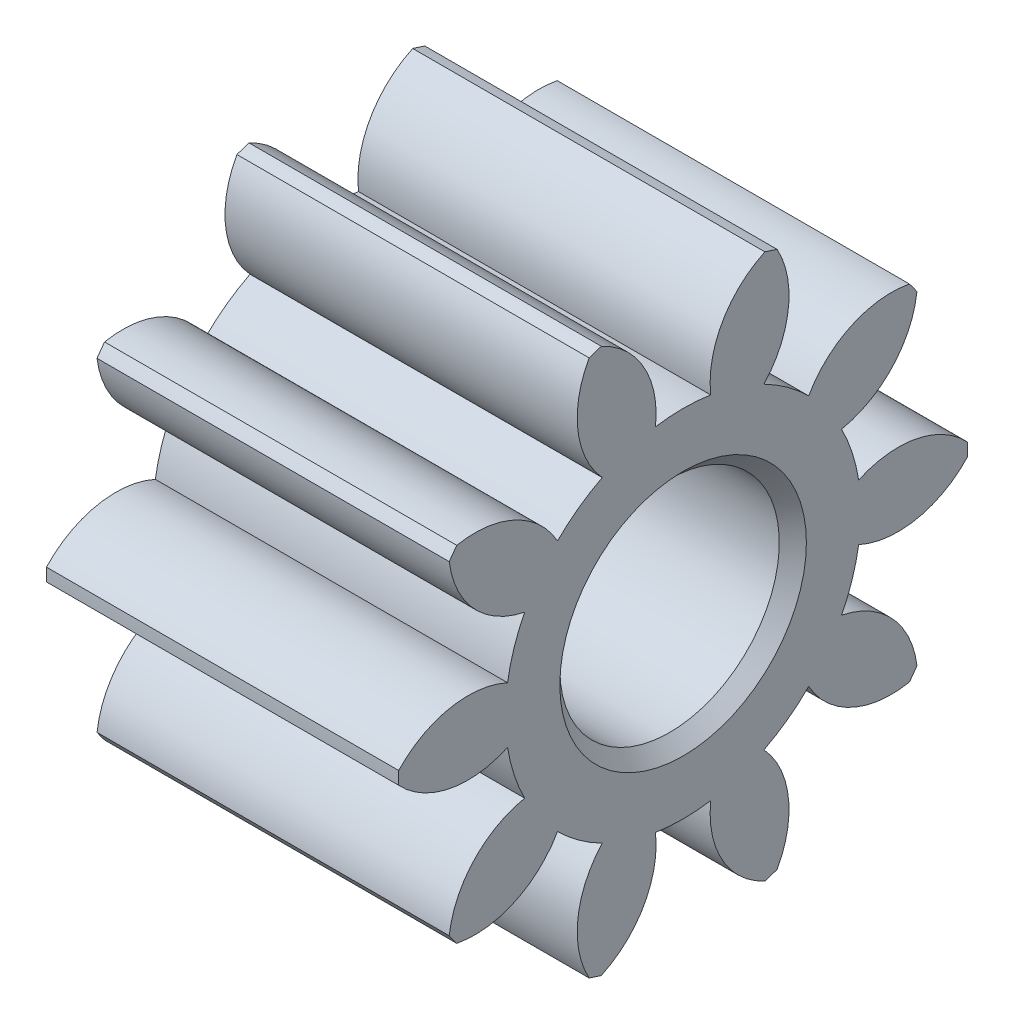
from build123d import *

# Parameters (mm, degrees)
BASPROSKE_W        = 13
BASPROSKE_H        = 10.5
TOOTHCUT_DEPTH     = 20.735754356
TEETHCUTS_COUNT    = 10
TEETHCUTS_ANGLE    = 324
BORSKE_R           = 1.5
BORE_DEPTH         = 50.0000508
CUT_EXTRUDE1_REACH = 21.504
SKETCH1_R          = 4.05
CHAMFER1_SIZE      = 0.5


with BuildPart() as part:
    # BasProSke → Base-Revolve (revolve)
    with BuildSketch(Plane(origin=(0, 0, 0), x_dir=(1, 0, 0), z_dir=(0, 1, 0)), mode=Mode.PRIVATE) as base_revolve_sk:
        with Locations((6.5, 5.25)):
            Rectangle(BASPROSKE_W, BASPROSKE_H)
    revolve(base_revolve_sk.sketch.rotate(Axis((-10, 0, 0), (1, 0, 0)), 180), axis=Axis((-10, 0, 0), (1, 0, 0)))

    # TooCutSke → ToothCut (cut, through all)
    with BuildSketch(Plane(origin=(0, 0, 0), x_dir=(0, 0, -1), z_dir=(1, 0, 0))):
        with BuildLine():
            ThreePointArc((1.019600066, 6.481797432), (0, 6.5615), (-1.019600066, 6.481797432))
            ThreePointArc((-1.019600066, 6.481797432), (-1.451036104, 8.608938557), (-3.053606956, 10.072712133))
            ThreePointArc((-3.053606956, 10.072712133), (0, 10.5254), (3.053606956, 10.072712133))
            ThreePointArc((3.053606956, 10.072712133), (1.451036104, 8.608938557), (1.019600066, 6.481797432))
        make_face()
    toothcut = extrude(amount=TOOTHCUT_DEPTH, mode=Mode.SUBTRACT)

    # TeethCuts: ToothCut ×10 about axis
    teethcuts_axis = Axis((-10, 0, 0), (1, 0, 0))
    for i in range(1, TEETHCUTS_COUNT):
        add(toothcut.rotate(teethcuts_axis, i * TEETHCUTS_ANGLE / (TEETHCUTS_COUNT - 1)), mode=Mode.SUBTRACT)

    # BorSke → Bore (cut, symmetric)
    with BuildSketch(Plane(origin=(0, 0, 0), x_dir=(0, 0, -1), z_dir=(1, 0, 0))):
        with Locations(Location((0, 0, 0), (0, 0, 180))):
            Circle(BORSKE_R)
    extrude(amount=BORE_DEPTH, both=True, mode=Mode.SUBTRACT)

    # Sketch1 → Cut-Extrude1 (cut, up to next)
    with BuildSketch(Plane.ZY, mode=Mode.PRIVATE) as cut_extrude1_sk1:
        Circle(SKETCH1_R)
    cut_extrude1_tool1 = extrude(cut_extrude1_sk1.sketch, amount=-CUT_EXTRUDE1_REACH, mode=Mode.PRIVATE) & part.part
    add(cut_extrude1_tool1.solids().sort_by_distance((0, 0, 0))[0], mode=Mode.SUBTRACT)

    # Chamfer1
    chamfer1_edges = [part.edges().sort_by_distance(p)[0] for p in [
        (0, 0, -4.05),
        (13, 0, -4.05),
    ]]
    chamfer(chamfer1_edges, length=CHAMFER1_SIZE)


solid = part.part
